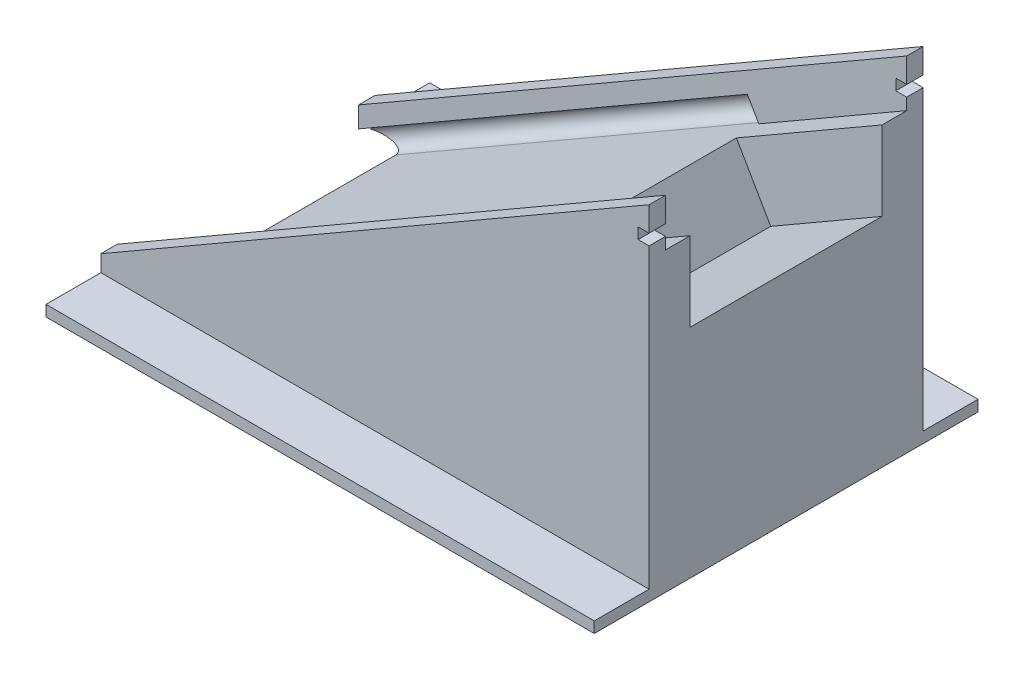
from build123d import *

# Parameters (mm, degrees)
SKETCH3_W               = 100
SKETCH3_H               = 70
BOSS_EXTRUDE2_DEPTH     = 2
BOSS_EXTRUDE3_DEPTH     = 25
SKETCH7_W               = 35
SKETCH7_H               = 35
CUT_EXTRUDE3_DEPTH      = 20
CUT_EXTRUDE1_DEPTH      = 125.171613843
CUT_EXTRUDE1_DEPTH_BACK = 80
SKETCH8_W               = 44
SKETCH8_H               = 7.480636053
CUT_EXTRUDE4_DEPTH      = 101.661811193
SKETCH9_W               = 3
SKETCH9_H               = 2
CUT_EXTRUDE5_DEPTH      = 2


with BuildPart() as part:
    # Sketch3 → Boss-Extrude2 (new body)
    with BuildSketch(Plane(origin=(0, 0, 0), x_dir=(1, 0, 0), z_dir=(0, 1, 0))):
        Rectangle(SKETCH3_W, SKETCH3_H)
    extrude(amount=BOSS_EXTRUDE2_DEPTH)

    # Sketch4 → Boss-Extrude3 (add, symmetric)
    with BuildSketch(Plane.XY):
        Polygon((50, 62.735026919), (50, 2), (-50, 2), (-50, 5), align=None)
    extrude(amount=BOSS_EXTRUDE3_DEPTH, both=True)

    # Sketch7 → Cut-Extrude3 (cut)
    with BuildSketch(Plane(origin=(-14.665063509, 25.400635095, 0), x_dir=(0.8660254037844414, 0.49999999999999517, 0), z_dir=(-0.49999999999999517, 0.8660254037844414, 0))):
        with Locations((57.168783649, 0)):
            Rectangle(SKETCH7_W, SKETCH7_H)
    extrude(amount=-CUT_EXTRUDE3_DEPTH, mode=Mode.SUBTRACT)

    # Sketch5 → Cut-Extrude1 (cut, two sides: drawn at the far end of the back side and taken through both)
    with BuildSketch(Plane(origin=(-35.334936491, -20.400635095, 0), x_dir=(0, 0, -1), z_dir=(-0.8660254037844416, -0.4999999999999951, 0)).offset(-CUT_EXTRUDE1_DEPTH_BACK)):
        with BuildLine():
            Line((-22.5, -21.849490966), (22.5, -21.849490966))
            ThreePointArc((22.5, -21.849490966), (24.6, -23.949490966), (22.5, -26.049490966))
            Line((22.5, -26.049490966), (22, -26.049490966))
            Line((22, -26.049490966), (22, -29.330127019))
            Line((22, -29.330127019), (-22, -29.330127019))
            Line((-22, -29.330127019), (-22, -26.049490966))
            Line((-22, -26.049490966), (-22.5, -26.049490966))
            ThreePointArc((-22.5, -26.049490966), (-24.6, -23.949490966), (-22.5, -21.849490966))
        make_face()
    extrude(amount=CUT_EXTRUDE1_DEPTH + CUT_EXTRUDE1_DEPTH_BACK, mode=Mode.SUBTRACT)

    # Sketch8 → Cut-Extrude4 (cut, through all)
    with BuildSketch(Plane(origin=(33.947095812, 19.599364905, 0), x_dir=(0, 0, 1), z_dir=(-0.8660254037844414, -0.49999999999999517, 0))):
        with Locations((0, 25.589808993)):
            Rectangle(SKETCH8_W, SKETCH8_H)
    extrude(amount=-CUT_EXTRUDE4_DEPTH, mode=Mode.SUBTRACT)

    # Sketch9 → Cut-Extrude5 (cut)
    with BuildSketch(Plane(origin=(50, 0, 0), x_dir=(0, 0, -1), z_dir=(1, 0, 0))):
        with Locations((-23.5, 57.235026919)):
            Rectangle(SKETCH9_W, SKETCH9_H)
        with Locations((23.5, 57.235026919)):
            Rectangle(SKETCH9_W, SKETCH9_H)
    extrude(amount=-CUT_EXTRUDE5_DEPTH, mode=Mode.SUBTRACT)


solid = part.part
